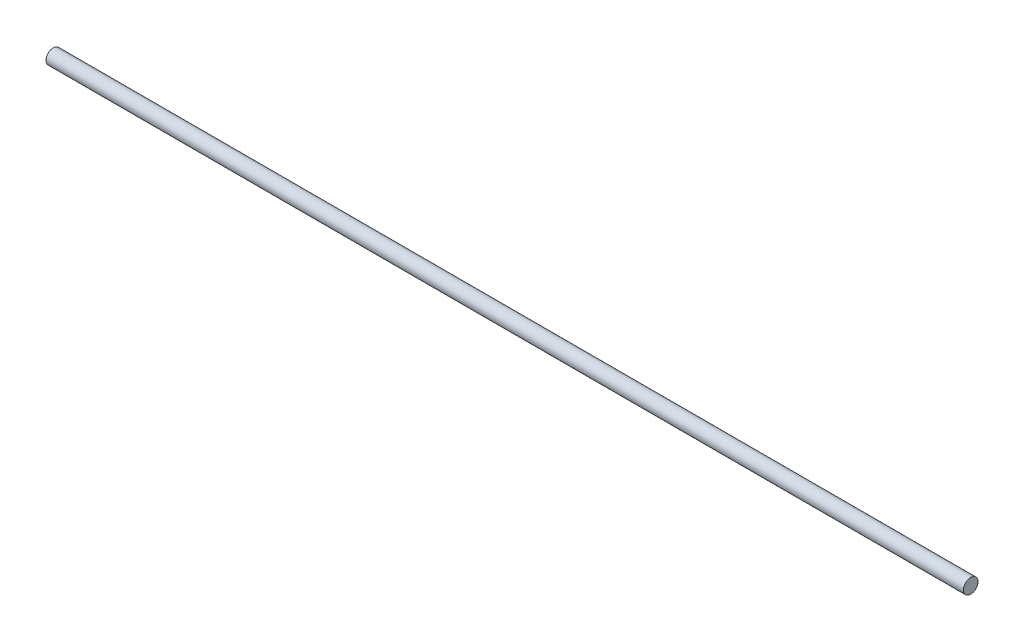
from build123d import *

# Parameters (mm, degrees)
SKETCH1_R           = 10
BOSS_EXTRUDE1_DEPTH = 1260


with BuildPart() as part:
    # Sketch1 → Boss-Extrude1 (new body)
    with BuildSketch(Plane(origin=(0, 0, 0), x_dir=(0, 0, -1), z_dir=(1, 0, 0))):
        Circle(SKETCH1_R)
    extrude(amount=BOSS_EXTRUDE1_DEPTH)


solid = part.part
